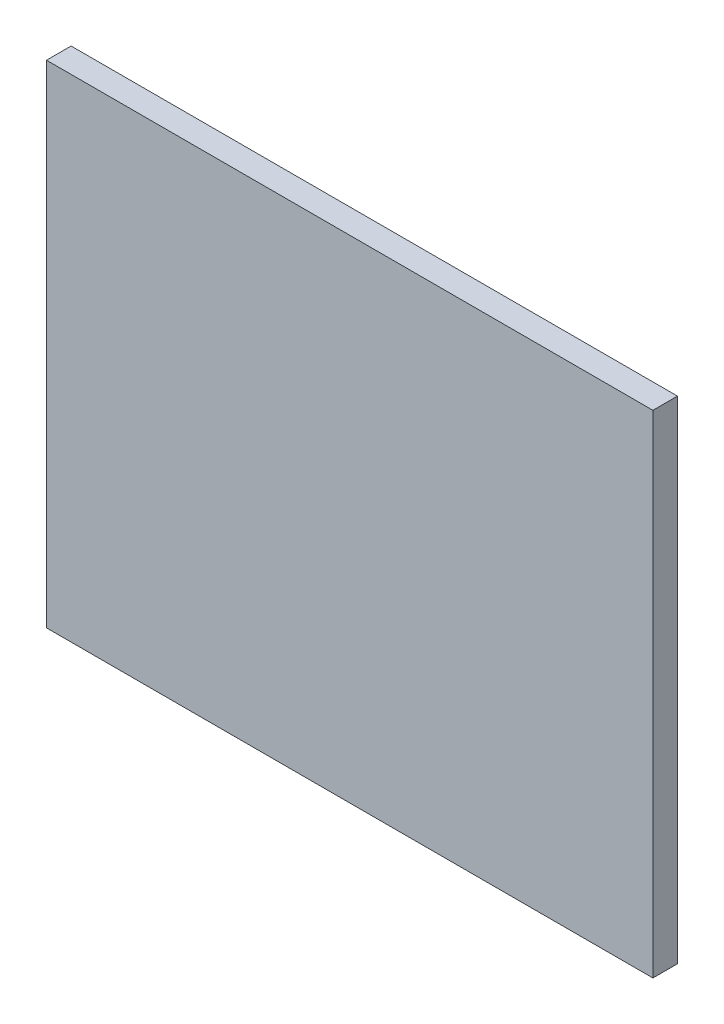
from build123d import *

# Parameters (mm, degrees)
ESQUISSE1_W        = 74
ESQUISSE1_H        = 60
BOSS_EXTRU_1_DEPTH = 3


with BuildPart() as part:
    # Esquisse1 → Boss.-Extru.1 (new body)
    with BuildSketch(Plane.XY):
        with Locations((37, 30)):
            Rectangle(ESQUISSE1_W, ESQUISSE1_H)
    extrude(amount=BOSS_EXTRU_1_DEPTH)


solid = part.part
